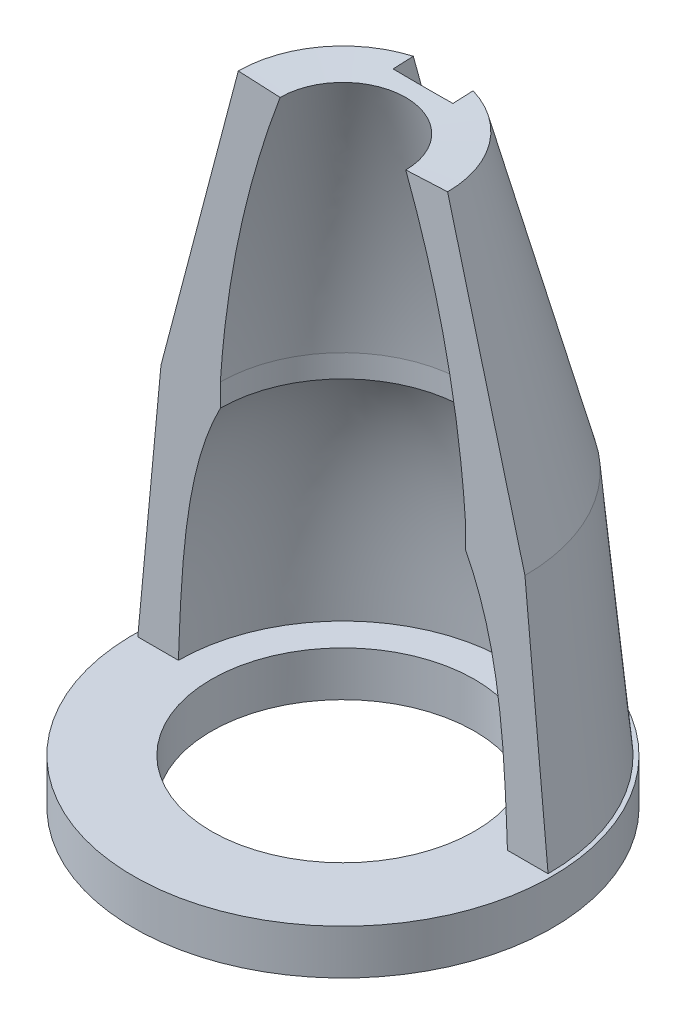
from build123d import *

# Parameters (mm, degrees)
REVOLUCI_N1_ANGLE          = 180
CROQUIS2_R                 = 7
SALIENTE_EXTRUIR1_DEPTH    = 1.5
CROQUIS3_R                 = 4.4
CORTAR_EXTRUIR1_DEPTH      = 3
CORTAR_EXTRUIR6_DEPTH      = 1
CORTAR_EXTRUIR6_DEPTH_BACK = 1


with BuildPart() as part:
    # Croquis1 → Revolución1 (revolve)
    with BuildSketch(Plane.XY):
        with BuildLine():
            Line((0, 0), (0, 1.5))
            Line((0, 1.5), (5.5, 1.5))
            add(Edge.make_bspline(
                [(4.1, 9.5), (5.288924253, 7.200139579), (5.394574911, 4.30480441), (5.5, 1.5)],
                knots=[0, 0, 0, 0, 0.667768354, 0.667768354, 0.667768354, 0.667768354], degree=3))
            Line((4.1, 9.5), (4.1, 10.258992023))
            add(Edge.make_bspline(
                [(2.1, 19.5), (3.785937607, 15.030292429), (4.1, 10.258992023)],
                knots=[0, 0, 0, 1, 1, 1], degree=2))
            Line((2.1, 19.5), (3.498445406, 19.565957924))
            Line((3.498445406, 19.565957924), (6.084400468, 9.749308612))
            Line((6.084400468, 9.749308612), (7, 0))
            Line((7, 0), (0, 0))
        make_face()
    revolve(axis=Axis((0, 1.5, 0), (0, 1, 0)), revolution_arc=REVOLUCI_N1_ANGLE)

    # Croquis2 → Saliente-Extruir1 (add)
    with BuildSketch(Plane.XZ):
        Circle(CROQUIS2_R)
    extrude(amount=-SALIENTE_EXTRUIR1_DEPTH)

    # Croquis3 → Cortar-Extruir1 (cut)
    with BuildSketch(Plane.XZ):
        Circle(CROQUIS3_R)
    extrude(amount=-CORTAR_EXTRUIR1_DEPTH, mode=Mode.SUBTRACT)

    # Croquis4 → Cortar-Extruir6 (cut, two sides: drawn at the far end of the back side and taken through both)
    with BuildSketch(Plane(origin=(0, 0, 0), x_dir=(0, 0, -1), z_dir=(1, 0, 0)).offset(-CORTAR_EXTRUIR6_DEPTH_BACK)):
        Polygon((6.768665295, 7.140982448), (6.068665295, 7.140982448), (2.336951323, 20.779679502), (3.498445406, 19.565957924), (4.898652058, 19.565957924), (8.788984747, 7.140982448), align=None)
    extrude(amount=CORTAR_EXTRUIR6_DEPTH + CORTAR_EXTRUIR6_DEPTH_BACK, mode=Mode.SUBTRACT)


solid = part.part
